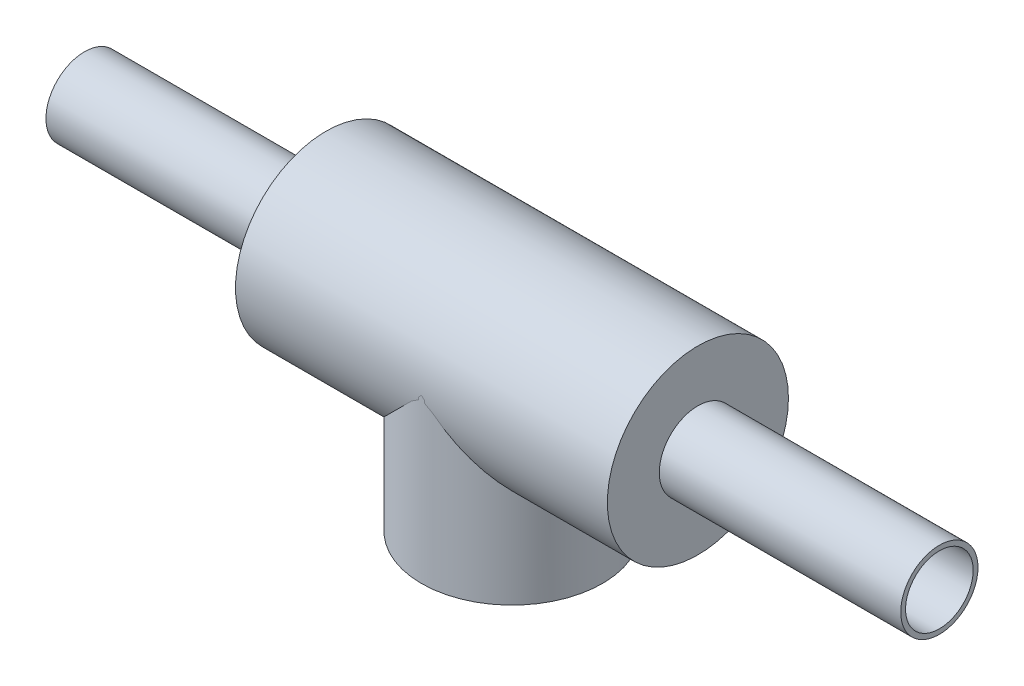
from build123d import *

# Parameters (mm, degrees)
SKETCH_1_R          = 37.5
SKETCH_1_R_2        = 35
SKETCH_4_R          = 37.5
SKETCH_4_R_2        = 35
EXTRUDE_1_DEPTH     = 75
EXTRUDE_START       = 2
SKETCH_5_R          = 37.5
SKETCH_5_R_2        = 14
EXTRUDE_2_DEPTH     = 2
EXTRUDE_START_2     = 100
SKETCH_6_R          = 16
SKETCH_6_R_2        = 14
EXTRUDE_3_DEPTH     = 100
SKETCH_7_W          = 164.087293052
SKETCH_7_H          = 105
CUT_EXTRUDE_1_DEPTH = 265.464553435


with BuildPart() as part:
    # 扫描2: sweep along a path in 草图2
    with BuildLine(Plane(origin=(0, 0, 0), x_dir=(0, 0, -1), z_dir=(1, 0, 0))) as sweep_2_path:
        Line((0, 0), (40, 0))
        ThreePointArc((40, 0), (68.284271247, 11.715728753), (80, 40))
        Line((80, 40), (80, 120))
    # 草图1 → 扫描2 (sweep)
    with BuildSketch(Plane.XY):
        Circle(SKETCH_1_R)
        Circle(SKETCH_1_R_2, mode=Mode.SUBTRACT)
    sweep(path=sweep_2_path.line)

    # 草图4 → 凸台-拉伸1 (add, symmetric)
    with BuildSketch(Plane(origin=(0, 0, 0), x_dir=(0, 0, -1), z_dir=(1, 0, 0))):
        with Locations((80, 120)):
            Circle(SKETCH_4_R)
        with Locations((80, 120)):
            Circle(SKETCH_4_R_2, mode=Mode.SUBTRACT)
    extrude(amount=EXTRUDE_1_DEPTH, both=True)

    # 草图5 → 凸台-拉伸2 (add)
    with BuildSketch(Plane(origin=(75, 0, 0), x_dir=(0, 0, -1), z_dir=(1, 0, 0)).offset(EXTRUDE_START)):
        with Locations((80, 120)):
            Circle(SKETCH_5_R)
        with Locations((80, 120)):
            Circle(SKETCH_5_R_2, mode=Mode.SUBTRACT)
    extrude_2 = extrude(amount=-EXTRUDE_2_DEPTH)

    # 草图6 → 凸台-拉伸3 (add)
    with BuildSketch(Plane(origin=(77, 0, 0), x_dir=(0, 0, -1), z_dir=(1, 0, 0)).offset(EXTRUDE_START_2)):
        with Locations((80, 120)):
            Circle(SKETCH_6_R)
        with Locations((80, 120)):
            Circle(SKETCH_6_R_2, mode=Mode.SUBTRACT)
    extrude_3 = extrude(amount=-EXTRUDE_3_DEPTH)

    # 镜向1: 凸台-拉伸2, 凸台-拉伸3 across plane
    add(extrude_2.mirror(Plane(origin=(0, 0, 0), x_dir=(0, 0, 1), z_dir=(1, 0, 0))))
    add(extrude_3.mirror(Plane(origin=(0, 0, 0), x_dir=(0, 0, 1), z_dir=(1, 0, 0))))

    # 草图7 → 切除-拉伸1 (cut, through all)
    with BuildSketch(Plane.XY):
        Rectangle(SKETCH_7_W, SKETCH_7_H)
    extrude(amount=-CUT_EXTRUDE_1_DEPTH, mode=Mode.SUBTRACT)


solid = part.part
